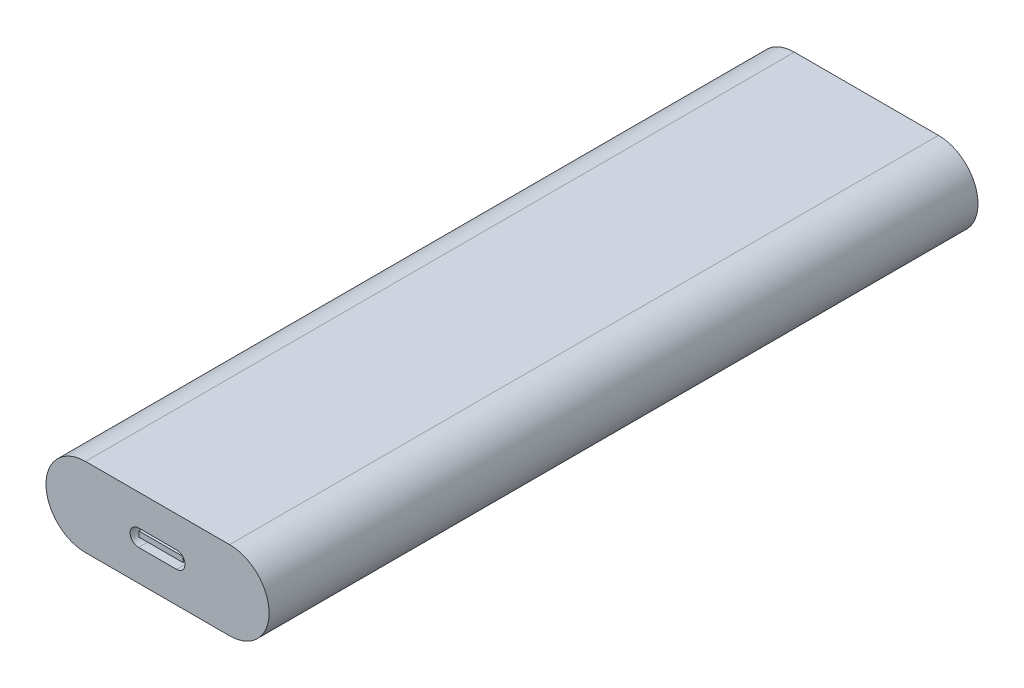
from build123d import *

# Parameters (mm, degrees)
BOSS_EXTRUDE1_DEPTH = 107.7
CUT_EXTRUDE1_DEPTH  = 6.5
SKETCH3_W           = 6.69
SKETCH3_H           = 0.8
BOSS_EXTRUDE2_DEPTH = 6


with BuildPart() as part:
    # Sketch1 → Boss-Extrude1 (new body)
    with BuildSketch(Plane.XY):
        with BuildLine():
            Line((-10.95, 6), (10.95, 6))
            ThreePointArc((10.95, 6), (16.95, 0), (10.95, -6))
            Line((10.95, -6), (-10.95, -6))
            ThreePointArc((-10.95, -6), (-16.95, 0), (-10.95, 6))
        make_face()
    extrude(amount=-BOSS_EXTRUDE1_DEPTH)

    # Sketch2 → Cut-Extrude1 (cut)
    with BuildSketch(Plane.XY):
        with BuildLine():
            Line((-2.89, 1.28), (2.89, 1.28))
            ThreePointArc((2.89, 1.28), (4.17, 0), (2.89, -1.28))
            Line((2.89, -1.28), (-2.89, -1.28))
            ThreePointArc((-2.89, -1.28), (-4.17, 0), (-2.89, 1.28))
        make_face()
    extrude(amount=-CUT_EXTRUDE1_DEPTH, mode=Mode.SUBTRACT)

    # Sketch3 → Boss-Extrude2 (add)
    with BuildSketch(Plane.XY.offset(-6.5)):
        Rectangle(SKETCH3_W, SKETCH3_H)
    extrude(amount=BOSS_EXTRUDE2_DEPTH)


solid = part.part
